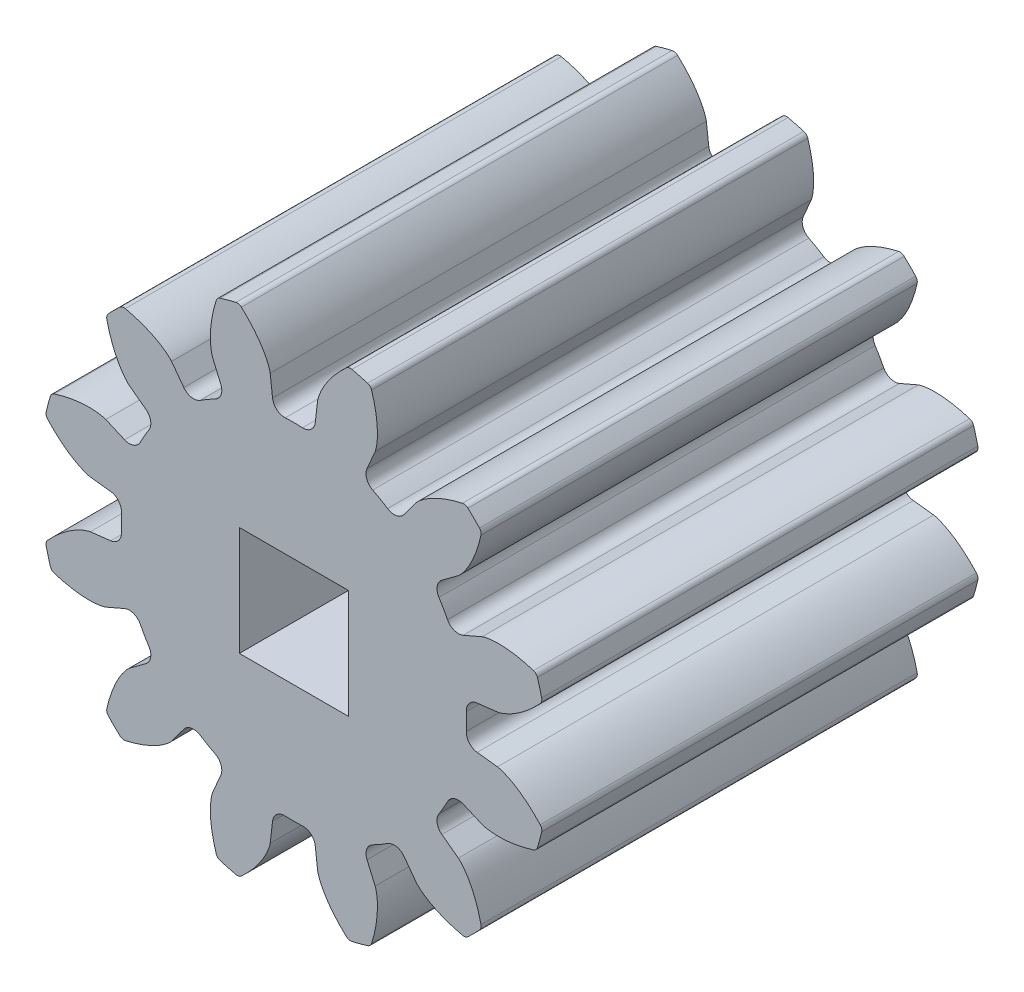
from build123d import *

# Parameters (mm, degrees)
SKETCH1_R                                 = 7.408333333
BOSS_EXTRUDE1_DEPTH                       = 12.7
CUT_EXTRUDE_DCLTBC_DEPTH                  = 17.463802889
FILLET_TIP_DCLTBC_R                       = 0.177538081
FILLET_ROOT_DCLTBC_R                      = 0.355076163
CIRPATTERN_DCLTBC_COUNT                   = 12
FILLET_TIP_DCLTBC_OF_CIRPATTERN_DCLTBC_R  = 0.177538081
FILLET_ROOT_DCLTBC_OF_CIRPATTERN_DCLTBC_R = 0.355076163
SKETCH4_W                                 = 3.175
SKETCH4_H                                 = 3.175
CUT_EXTRUDE2_DEPTH                        = 17.293789538


with BuildPart() as part:
    # Sketch1 → Boss-Extrude1 (new body)
    with BuildSketch(Plane.XY):
        Circle(SKETCH1_R)
    extrude(amount=BOSS_EXTRUDE1_DEPTH)

    # DCLTBC → Cut-Extrude-DCLTBC (cut, through all)
    with BuildSketch(Plane.XY):
        with BuildLine():
            Line((-0.690598508, 5.926950078), (-0.581811335, 4.993301754))
            ThreePointArc((-0.581811335, 4.993301754), (0, 5.027083333), (0.581811335, 4.993301754))
            Line((0.581811335, 4.993301754), (0.690598508, 5.926950078))
            add(Edge.make_bspline(
                [(0.690598508, 5.926950078), (0.690911872, 5.929318191), (0.691904892, 5.935944647), (0.694232443, 5.948407954), (0.69866684, 5.96863478), (0.70524939, 5.994230847), (0.714822349, 6.027084964), (0.727462413, 6.065467787), (0.74277265, 6.107282331), (0.760950457, 6.152345854), (0.780422108, 6.196898763), (0.801081108, 6.240942495), (0.822769247, 6.284441008), (0.8503395, 6.336662498), (0.885198626, 6.398612769), (0.92853373, 6.469984516), (0.980716028, 6.54965538), (1.037091207, 6.629400976), (1.095172788, 6.706647925), (1.156800213, 6.78320647), (1.218511327, 6.856219389), (1.285554849, 6.930432721), (1.348944008, 6.998115798), (1.423150182, 7.07205666), (1.483972917, 7.131183599), (1.549410219, 7.190627906), (1.581641114, 7.219315962), (1.598273068, 7.233873511)],
                knots=[0, 0, 0, 0, 0, 0.005376749, 0.015083688, 0.02853182, 0.046610139, 0.064854849, 0.092110525, 0.119476176, 0.146842496, 0.174208854, 0.201574956, 0.228941013, 0.256307345, 0.307035032, 0.361767352, 0.416499661, 0.471231937, 0.525964282, 0.580696615, 0.635428982, 0.690161387, 0.744893688, 0.799626082, 0.854358408, 0.909090915, 0.909090915, 0.909090915, 0.909090915, 0.909090915], degree=4))
            ThreePointArc((1.598273068, 7.233873511), (0, 7.408333333), (-1.598273068, 7.233873511))
            add(Edge.make_bspline(
                [(-0.690598508, 5.926950078), (-0.690911872, 5.929318191), (-0.691904892, 5.935944647), (-0.694232443, 5.948407954), (-0.69866684, 5.96863478), (-0.70524939, 5.994230847), (-0.714822349, 6.027084964), (-0.727462413, 6.065467787), (-0.74277265, 6.107282331), (-0.760950457, 6.152345854), (-0.780422108, 6.196898763), (-0.801081108, 6.240942495), (-0.822769247, 6.284441008), (-0.8503395, 6.336662498), (-0.885198626, 6.398612769), (-0.92853373, 6.469984516), (-0.980716028, 6.54965538), (-1.037091207, 6.629400976), (-1.095172788, 6.706647925), (-1.156800213, 6.78320647), (-1.218511327, 6.856219389), (-1.285554849, 6.930432721), (-1.348944008, 6.998115798), (-1.423150182, 7.07205666), (-1.483972917, 7.131183599), (-1.549410219, 7.190627906), (-1.581641114, 7.219315962), (-1.598273068, 7.233873511)],
                knots=[0, 0, 0, 0, 0, 0.005376749, 0.015083688, 0.02853182, 0.046610139, 0.064854849, 0.092110525, 0.119476176, 0.146842496, 0.174208854, 0.201574956, 0.228941013, 0.256307345, 0.307035032, 0.361767352, 0.416499661, 0.471231937, 0.525964282, 0.580696615, 0.635428982, 0.690161387, 0.744893688, 0.799626082, 0.854358408, 0.909090915, 0.909090915, 0.909090915, 0.909090915, 0.909090915], degree=4))
        make_face()
    cut_extrude_dcltbc = extrude(amount=CUT_EXTRUDE_DCLTBC_DEPTH, mode=Mode.SUBTRACT)

    # Fillet-Tip-DCLTBC
    fillet_tip_dcltbc_edges = [part.edges().sort_by_distance(p)[0] for p in [
        (1.598273068, 7.233873511, 6.35),
        (-1.598273068, 7.233873511, 6.35),
    ]]
    fillet(fillet_tip_dcltbc_edges, radius=FILLET_TIP_DCLTBC_R)

    # Fillet-Root-DCLTBC
    fillet_root_dcltbc_edges = [part.edges().sort_by_distance(p)[0] for p in [
        (0.581811335, 4.993301754, 6.35),
        (-0.581811335, 4.993301754, 6.35),
    ]]
    fillet(fillet_root_dcltbc_edges, radius=FILLET_ROOT_DCLTBC_R)

    # CirPattern-DCLTBC: Cut-Extrude-DCLTBC ×12 about axis
    cirpattern_dcltbc_axis = Axis((0, 0, 12.7), (0, 0, 1))
    for i in range(1, CIRPATTERN_DCLTBC_COUNT):
        add(cut_extrude_dcltbc.rotate(cirpattern_dcltbc_axis, i * 360 / CIRPATTERN_DCLTBC_COUNT), mode=Mode.SUBTRACT)

    # Fillet-Tip-DCLTBC of CirPattern-DCLTBC
    fillet_tip_dcltbc_of_cirpattern_dcltbc_edges = [part.edges().sort_by_distance(p)[0] for p in [
        (-2.232791676, 7.063854763, 6.35),
        (-5.001081835, 5.465581694, 6.35),
        (-5.465581694, 5.001081835, 6.35),
        (-7.063854763, 2.232791676, 6.35),
        (-7.233873511, 1.598273068, 6.35),
        (-7.233873511, -1.598273068, 6.35),
        (-7.063854763, -2.232791676, 6.35),
        (-5.465581694, -5.001081835, 6.35),
        (-5.001081835, -5.465581694, 6.35),
        (-2.232791676, -7.063854763, 6.35),
        (-1.598273068, -7.233873511, 6.35),
        (1.598273068, -7.233873511, 6.35),
        (2.232791676, -7.063854763, 6.35),
        (5.001081835, -5.465581694, 6.35),
        (5.465581694, -5.001081835, 6.35),
        (7.063854763, -2.232791676, 6.35),
        (7.233873511, -1.598273068, 6.35),
        (7.233873511, 1.598273068, 6.35),
        (7.063854763, 2.232791676, 6.35),
        (5.465581694, 5.001081835, 6.35),
        (5.001081835, 5.465581694, 6.35),
        (2.232791676, 7.063854763, 6.35),
    ]]
    fillet(fillet_tip_dcltbc_of_cirpattern_dcltbc_edges, radius=FILLET_TIP_DCLTBC_OF_CIRPATTERN_DCLTBC_R)

    # Fillet-Root-DCLTBC of CirPattern-DCLTBC
    fillet_root_dcltbc_of_cirpattern_dcltbc_edges = [part.edges().sort_by_distance(p)[0] for p in [
        (-1.99278748, 4.615231836, 6.35),
        (-3.000514274, 4.0334205, 6.35),
        (-4.0334205, 3.000514274, 6.35),
        (-4.615231836, 1.99278748, 6.35),
        (-4.993301754, 0.581811335, 6.35),
        (-4.993301754, -0.581811335, 6.35),
        (-4.615231836, -1.99278748, 6.35),
        (-4.0334205, -3.000514274, 6.35),
        (-3.000514274, -4.0334205, 6.35),
        (-1.99278748, -4.615231836, 6.35),
        (-0.581811335, -4.993301754, 6.35),
        (0.581811335, -4.993301754, 6.35),
        (1.99278748, -4.615231836, 6.35),
        (3.000514274, -4.0334205, 6.35),
        (4.0334205, -3.000514274, 6.35),
        (4.615231836, -1.99278748, 6.35),
        (4.993301754, -0.581811335, 6.35),
        (4.993301754, 0.581811335, 6.35),
        (4.615231836, 1.99278748, 6.35),
        (4.0334205, 3.000514274, 6.35),
        (3.000514274, 4.0334205, 6.35),
        (1.99278748, 4.615231836, 6.35),
    ]]
    fillet(fillet_root_dcltbc_of_cirpattern_dcltbc_edges, radius=FILLET_ROOT_DCLTBC_OF_CIRPATTERN_DCLTBC_R)

    # Sketch4 → Cut-Extrude2 (cut, through all)
    with BuildSketch(Plane.XY.offset(12.7)):
        Rectangle(SKETCH4_W, SKETCH4_H)
    extrude(amount=-CUT_EXTRUDE2_DEPTH, mode=Mode.SUBTRACT)


solid = part.part
